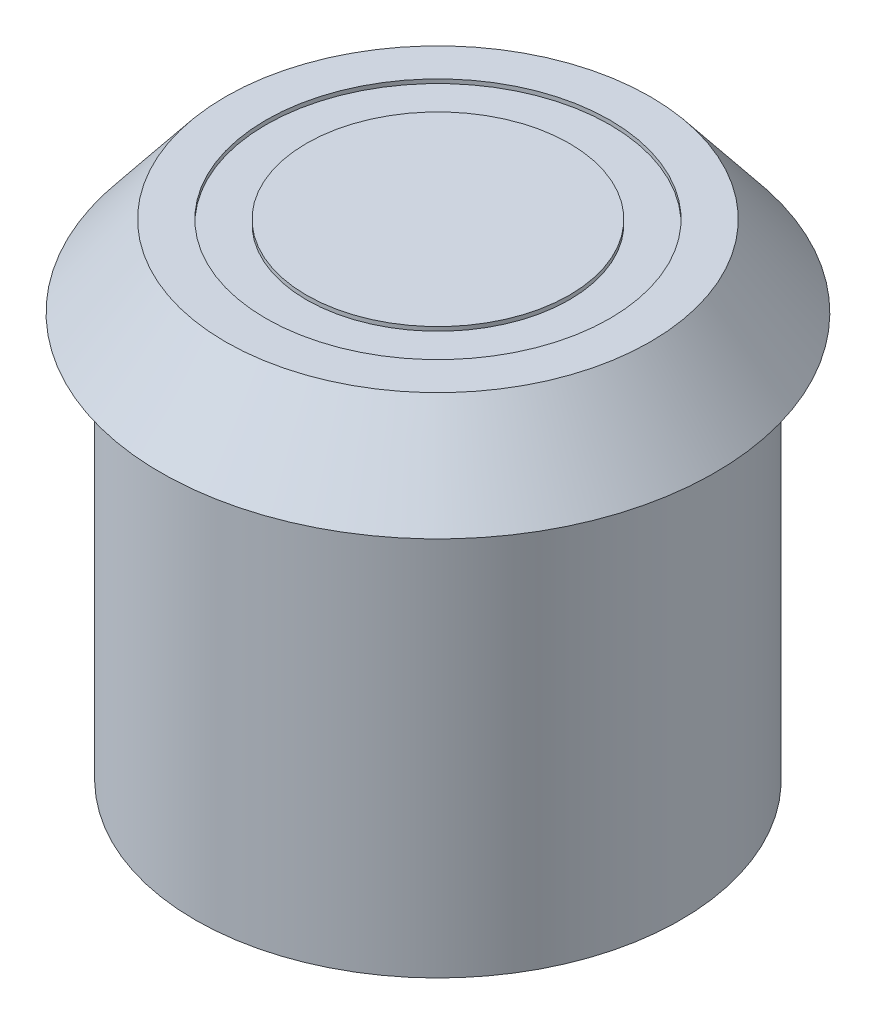
from build123d import *

# Parameters (mm, degrees)
ESQUISSE1_R             = 6
BOSS_EXTRU_1_DEPTH      = 10
ESQUISSE4_R             = 4.25
ESQUISSE4_R_2           = 3.25
ENL_V_MAT_EXTRU_1_DEPTH = 0.1


with BuildPart() as part:
    # Esquisse1 → Boss.-Extru.1 (new body)
    with BuildSketch(Plane(origin=(0, 0, 0), x_dir=(1, 0, 0), z_dir=(0, 1, 0))):
        with Locations(Location((0, 0, 0), (0, 0, 270))):
            Circle(ESQUISSE1_R)
    extrude(amount=-BOSS_EXTRU_1_DEPTH)

    # Esquisse3 → Révolution1 (revolve)
    with BuildSketch(Plane(origin=(0, 0, 0), x_dir=(0, 0, -1), z_dir=(1, 0, 0))):
        Polygon((0, 0), (0, 2), (5.25, 2), (6.85, 0), align=None)
    revolve(axis=Axis((0, 0, 0), (0, 1, 0)))

    # Esquisse4 → Enlèv. mat.-Extru.1 (cut)
    with BuildSketch(Plane(origin=(0, 2, 0), x_dir=(1, 0, 0), z_dir=(0, 1, 0))):
        with Locations(Location((0, 0, 0), (0, 0, 270))):
            Circle(ESQUISSE4_R)
        with Locations(Location((0, 0, 0), (0, 0, 270))):
            Circle(ESQUISSE4_R_2, mode=Mode.SUBTRACT)
    extrude(amount=-ENL_V_MAT_EXTRU_1_DEPTH, mode=Mode.SUBTRACT)


solid = part.part
